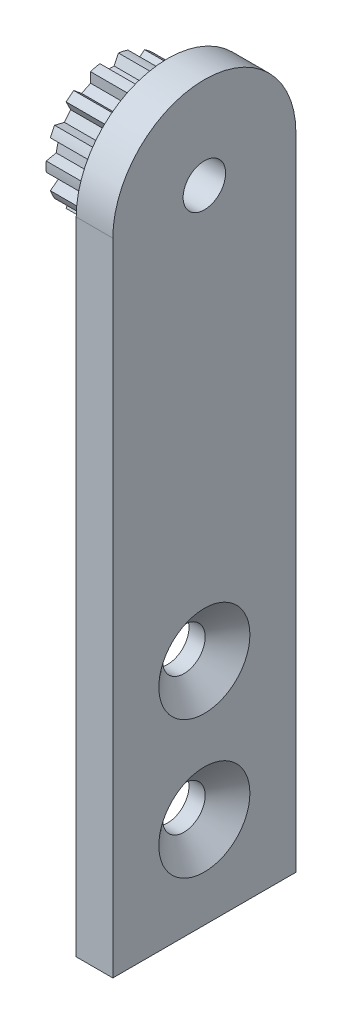
from build123d import *

# Parameters (mm, degrees)
SKETCH4_R                                         = 4.5339
SKETCH4_R_2                                       = 4.37515
CUT_EXTRUDE2_DEPTH                                = 4.064
CUT_EXTRUDE1_DEPTH                                = 4.064
CIRPATTERN1_COUNT                                 = 14
SKETCH6_R                                         = 1.5875
CUT_EXTRUDE3_DEPTH                                = 12.02520933
CUT_EXTRUDE4_DEPTH                                = 1.016
SKETCH11_R                                        = 6.731
CUT_EXTRUDE6_DEPTH                                = 2.54
SKETCH13_R                                        = 9.525
CUT_EXTRUDE7_DEPTH                                = 12.262802402
BOSS_EXTRUDE2_START                               = -4.064
SKETCH17_R                                        = 1.5875
SKETCH17_R_2                                      = 1.4732
BOSS_EXTRUDE2_DEPTH                               = 4.064
BOSS_EXTRUDE1_START                               = 2.54
SKETCH12_R                                        = 1.4732
BOSS_EXTRUDE1_DEPTH                               = 2.54
CSK_FOR_4_FLAT_HEAD_MACHINE_SCREW_100_D           = 2.9464
CSK_FOR_4_FLAT_HEAD_MACHINE_SCREW_100_CSINK_D     = 6.320409
CSK_FOR_4_FLAT_HEAD_MACHINE_SCREW_100_CSINK_ANGLE = 100


with BuildPart() as part:
    # Sketch1 → Revolve1 (revolve)
    with BuildSketch(Plane.XY, mode=Mode.PRIVATE) as revolve1_sk:
        with BuildLine():
            Line((-5.5626, 1.5875), (5.5626, 1.5875))
            Line((5.5626, 1.5875), (5.5626, 6.731))
            Line((5.5626, 6.731), (5.0419, 6.731))
            ThreePointArc((5.0419, 6.731), (4.654552953, 5.958878742), (4.5212, 5.1054))
            Line((4.5212, 5.1054), (4.5212, 4.5339))
            Line((4.5212, 4.5339), (0.4572, 4.5339))
            Line((0.4572, 4.5339), (0.4572, 5.6769))
            Line((0.4572, 5.6769), (-0.5969, 6.731))
            Line((-0.5969, 6.731), (-5.5626, 6.731))
            Line((-5.5626, 6.731), (-5.5626, 1.5875))
        make_face()
    revolve(revolve1_sk.sketch.rotate(Axis((-5.5626, 0, 0), (1, 0, 0)), 90), axis=Axis((-5.5626, 0, 0), (1, 0, 0)))

    # Sketch4 → Cut-Extrude2 (cut)
    with BuildSketch(Plane(origin=(0.4572, 0, 0), x_dir=(0, 0, -1), z_dir=(1, 0, 0))):
        Circle(SKETCH4_R)
        Circle(SKETCH4_R_2, mode=Mode.SUBTRACT)
    extrude(amount=CUT_EXTRUDE2_DEPTH, mode=Mode.SUBTRACT)

    # Sketch3 → Cut-Extrude1 (cut)
    with BuildSketch(Plane(origin=(0.4572, 0, 0), x_dir=(0, 0, -1), z_dir=(1, 0, 0))):
        with BuildLine():
            Line((-0.641613493, 4.327848154), (-0.345249615, 3.692293767))
            Line((-0.345249615, 3.692293767), (0.345249615, 3.692293767))
            Line((0.345249615, 3.692293767), (0.641613493, 4.327848154))
            ThreePointArc((0.641613493, 4.327848154), (0, 4.37515), (-0.641613493, 4.327848154))
        make_face()
    cut_extrude1 = extrude(amount=CUT_EXTRUDE1_DEPTH, mode=Mode.SUBTRACT)

    # CirPattern1: Cut-Extrude1 ×14 about axis
    cirpattern1_axis = Axis((0, 0, 0), (1, 0, 0))
    for i in range(1, CIRPATTERN1_COUNT):
        add(cut_extrude1.rotate(cirpattern1_axis, i * 360 / CIRPATTERN1_COUNT), mode=Mode.SUBTRACT)

    # Sketch6 → Cut-Extrude3 (cut, through all)
    with BuildSketch(Plane(origin=(0, 0, 0), x_dir=(1, 0, 0), z_dir=(0, 1, 0))):
        with Locations(Location((-2.5527, 0, 0), (0, 0, 90))):
            Circle(SKETCH6_R)
    extrude(amount=CUT_EXTRUDE3_DEPTH, mode=Mode.SUBTRACT)

    # Sketch11 → Cut-Extrude6 (cut)
    with BuildSketch(Plane.ZY.offset(-4.5212)):
        Circle(SKETCH11_R)
    extrude(amount=-CUT_EXTRUDE6_DEPTH, mode=Mode.SUBTRACT)


with BuildPart() as body_2:
    # Sketch7 → Revolve2 (revolve)
    with BuildSketch(Plane.XY, mode=Mode.PRIVATE) as revolve2_sk:
        Polygon((-3.7211, 6.731), (-2.5527, 6.731), (-2.5527, 1.9685), (-3.7211, 1.9685), (-3.9751, 2.2225), (-3.9751, 6.477), align=None)
    revolve(revolve2_sk.sketch.rotate(Axis((-2.5527, 1.9685, 0), (0, 1, 0)), 270), axis=Axis((-2.5527, 1.9685, 0), (0, 1, 0)))

    # Sketch8 → Cut-Extrude4 (cut)
    with BuildSketch(Plane(origin=(0, 6.731, 0), x_dir=(1, 0, 0), z_dir=(0, 1, 0))):
        Polygon((-2.5527, 0.821223023), (-3.2639, 0.410611511), (-3.2639, -0.410611511), (-2.5527, -0.821223023), (-1.8415, -0.410611511), (-1.8415, 0.410611511), align=None)
    extrude(amount=-CUT_EXTRUDE4_DEPTH, mode=Mode.SUBTRACT)


with BuildPart() as cut_extrude7_tool:
    # Sketch13 → Cut-Extrude7 (new, through all)
    with BuildSketch(Plane(origin=(0.4572, 0, 0), x_dir=(0, 0, -1), z_dir=(1, 0, 0))):
        Circle(SKETCH13_R)
    extrude(amount=-CUT_EXTRUDE7_DEPTH)


with BuildPart() as part_1:
    add(part.part)

    # Cut-Extrude7: cut by cut_extrude7_tool
    add(cut_extrude7_tool.part, mode=Mode.SUBTRACT)

    # Sketch17 → Boss-Extrude2 (add)
    with BuildSketch(Plane.ZY.offset(-0.4572).offset(BOSS_EXTRUDE2_START)):
        Circle(SKETCH17_R)
        Circle(SKETCH17_R_2, mode=Mode.SUBTRACT)
    extrude(amount=BOSS_EXTRUDE2_DEPTH)

    # Sketch12 → Boss-Extrude1 (add)
    with BuildSketch(Plane(origin=(4.5212, 0, 0), x_dir=(0, 0, -1), z_dir=(1, 0, 0)).offset(BOSS_EXTRUDE1_START)):
        with BuildLine():
            Line((6.35, 0), (6.35, -44.45))
            Line((6.35, -44.45), (-6.35, -44.45))
            Line((-6.35, -44.45), (-6.35, 0))
            ThreePointArc((-6.35, 0), (0, 6.35), (6.35, 0))
        make_face()
        with Locations(Location((0, 0, 0), (0, 0, 180))):
            Circle(SKETCH12_R, mode=Mode.SUBTRACT)
    extrude(amount=-BOSS_EXTRUDE1_DEPTH)

    # CSK for #4 Flat Head Machine Screw (100)1 (through all)
    with Locations(Plane(origin=(7.0612, 0, 0), x_dir=(0, 0, -1), z_dir=(1, 0, 0))):
        with Locations((0, -28.575), (0, -38.1)):
            CounterSinkHole(CSK_FOR_4_FLAT_HEAD_MACHINE_SCREW_100_D / 2, CSK_FOR_4_FLAT_HEAD_MACHINE_SCREW_100_CSINK_D / 2, counter_sink_angle=CSK_FOR_4_FLAT_HEAD_MACHINE_SCREW_100_CSINK_ANGLE)


with BuildPart() as body_2_1:
    add(body_2.part)

    # Cut-Extrude7: cut by cut_extrude7_tool
    add(cut_extrude7_tool.part, mode=Mode.SUBTRACT)


solid = part_1.part
